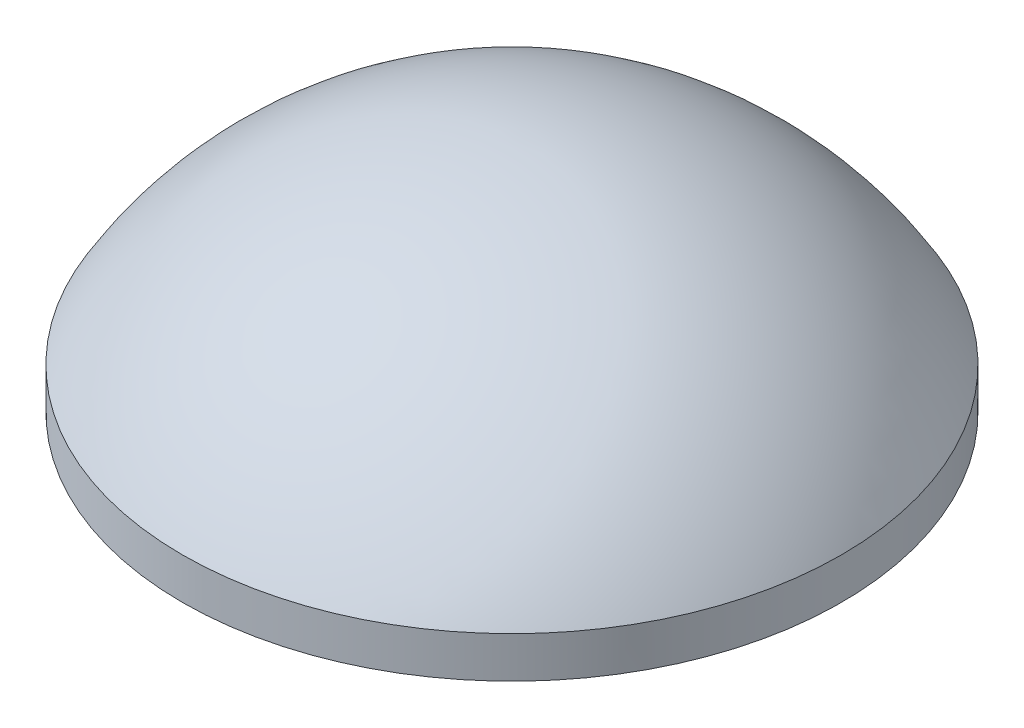
from build123d import *


with BuildPart() as part:
    # Skizze1 → Rotation1 (revolve)
    with BuildSketch(Plane.XY, mode=Mode.PRIVATE) as rotation1_sk:
        with BuildLine():
            Line((-4, 0), (0, 0))
            Line((0, 0), (0, 2.8))
            ThreePointArc((0, 2.8), (-2.307054399, 2.18400765), (-4, 0.5))
            Line((-4, 0.5), (-4, 0))
        make_face()
    revolve(rotation1_sk.sketch.rotate(Axis((0, 66.724398868, 0), (0, -1, 0)), 270), axis=Axis((0, 66.724398868, 0), (0, -1, 0)))


solid = part.part
